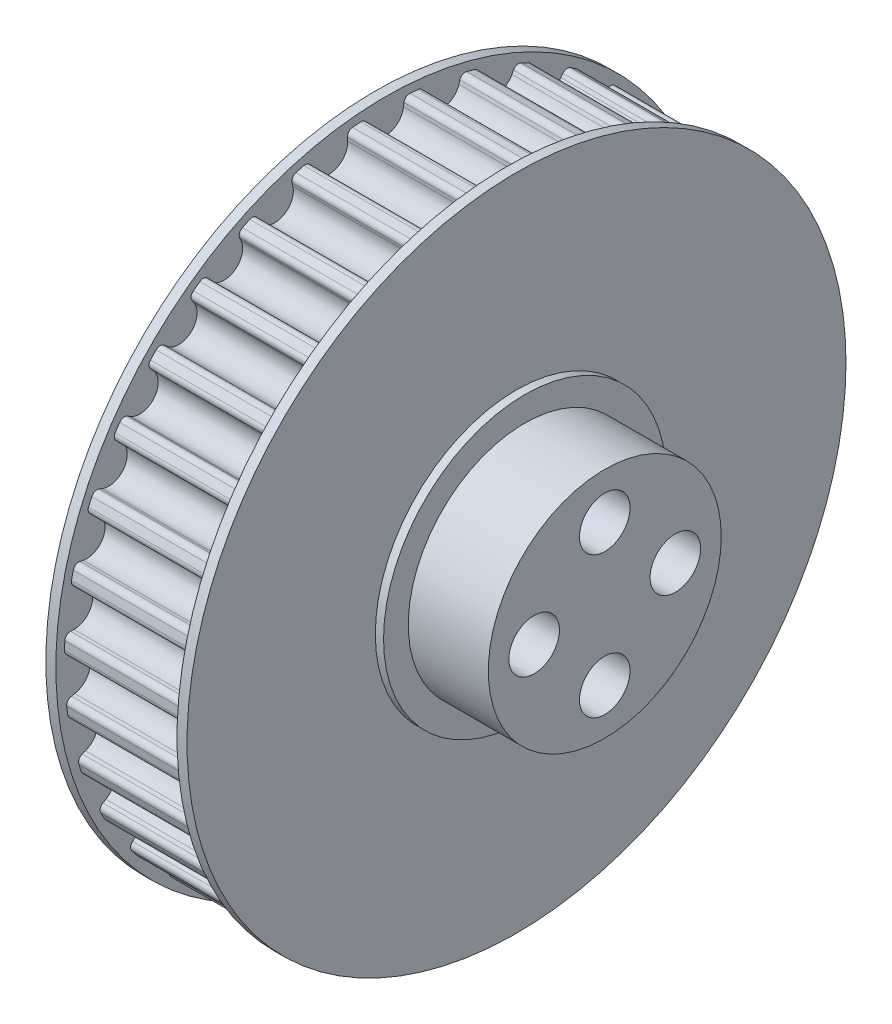
from build123d import *

# Parameters (mm, degrees)
SKETCH_1_W               = 10.3
SKETCH_1_H               = 27.278
CUT_EXTRUDE_2_REACH      = 41.928
PATTERN_CIRCULAR_3_COUNT = 35
SKETCH_7_R               = 28
EXTRUDE_1_DEPTH          = 0.85
SKETCH_8_R               = 12
EXTRUDE_2_DEPTH          = 0.7
SKETCH_9_R               = 9.9
EXTRUDE_3_DEPTH          = 6.8
SKETCH_10_R              = 2.15
CUT_EXTRUDE_3_DEPTH      = 48.927027865


with BuildPart() as part:
    # 草图1 → 旋转1 (revolve)
    with BuildSketch(Plane.XY):
        with Locations((5.15, 13.639)):
            Rectangle(SKETCH_1_W, SKETCH_1_H)
    revolve(axis=Axis((0, 0, 0), (1, 0, 0)))

    # 草图6 → 切除-拉伸2 (cut, up to next)
    with BuildSketch(Plane(origin=(0, 0, 0), x_dir=(0, 0, -1), z_dir=(1, 0, 0)), mode=Mode.PRIVATE) as cut_extrude_2_sk1:
        with BuildLine():
            Line((1.583892871, 26.777178128), (1.548371997, 26.487883824))
            ThreePointArc((1.548371997, 26.487883824), (0, 25.118), (-1.548371997, 26.487883824))
            Line((-1.548371997, 26.487883824), (-1.583892871, 26.777178128))
            ThreePointArc((-1.583892871, 26.777178128), (-1.756322779, 27.090149167), (-2.097218942, 27.197260096))
            ThreePointArc((-2.097218942, 27.197260096), (-2.346390889, 27.17689706), (-2.595365746, 27.154251244))
            Line((-2.595365746, 27.154251244), (-2.792013735, 28.755820587))
            ThreePointArc((-2.792013735, 28.755820587), (0, 28.891046335), (2.792013735, 28.755820587))
            Line((2.792013735, 28.755820587), (2.595365746, 27.154251244))
            ThreePointArc((2.595365746, 27.154251244), (2.346390889, 27.17689706), (2.097218942, 27.197260096))
            ThreePointArc((2.097218942, 27.197260096), (1.756322779, 27.090149167), (1.583892871, 26.777178128))
        make_face()
    cut_extrude_2_tool1 = extrude(cut_extrude_2_sk1.sketch, amount=CUT_EXTRUDE_2_REACH, mode=Mode.PRIVATE) & part.part
    cut_extrude_2 = cut_extrude_2_tool1.solids().sort_by_distance((0, 27.368813, 0))[0]
    add(cut_extrude_2, mode=Mode.SUBTRACT)

    # 阵列(圆周)3: 切除-拉伸2 ×35 about axis
    pattern_circular_3_axis = Axis((-1, 0, 0), (1, 0, 0))
    for i in range(1, PATTERN_CIRCULAR_3_COUNT):
        add(cut_extrude_2.rotate(pattern_circular_3_axis, i * 360 / PATTERN_CIRCULAR_3_COUNT), mode=Mode.SUBTRACT)

    # 草图7 → 凸台-拉伸1 (add)
    with BuildSketch(Plane(origin=(10.3, 0, 0), x_dir=(0, 0, -1), z_dir=(1, 0, 0))):
        Circle(SKETCH_7_R)
    extrude_1 = extrude(amount=EXTRUDE_1_DEPTH)

    # 草图8 → 凸台-拉伸2 (add)
    with BuildSketch(Plane(origin=(11.15, 0, 0), x_dir=(0, 0, -1), z_dir=(1, 0, 0))):
        Circle(SKETCH_8_R)
    extrude_2 = extrude(amount=EXTRUDE_2_DEPTH)

    # 草图9 → 凸台-拉伸3 (add)
    with BuildSketch(Plane(origin=(11.85, 0, 0), x_dir=(0, 0, -1), z_dir=(1, 0, 0))):
        Circle(SKETCH_9_R)
    extrude_3 = extrude(amount=EXTRUDE_3_DEPTH)

    # 镜向1: 凸台-拉伸1, 凸台-拉伸2, 凸台-拉伸3 across plane
    add(extrude_1.mirror(Plane.ZY.offset(-5.15)))
    add(extrude_2.mirror(Plane.ZY.offset(-5.15)))
    add(extrude_3.mirror(Plane.ZY.offset(-5.15)))

    # 草图10 → 切除-拉伸3 (cut, through all)
    with BuildSketch(Plane(origin=(18.65, 0, 0), x_dir=(0, 0, -1), z_dir=(1, 0, 0))):
        with Locations((0, 6)):
            Circle(SKETCH_10_R)
        with Locations((6, 0)):
            Circle(SKETCH_10_R)
        with Locations((0, -6)):
            Circle(SKETCH_10_R)
        with Locations((-6, 0)):
            Circle(SKETCH_10_R)
    extrude(amount=-CUT_EXTRUDE_3_DEPTH, mode=Mode.SUBTRACT)


solid = part.part
